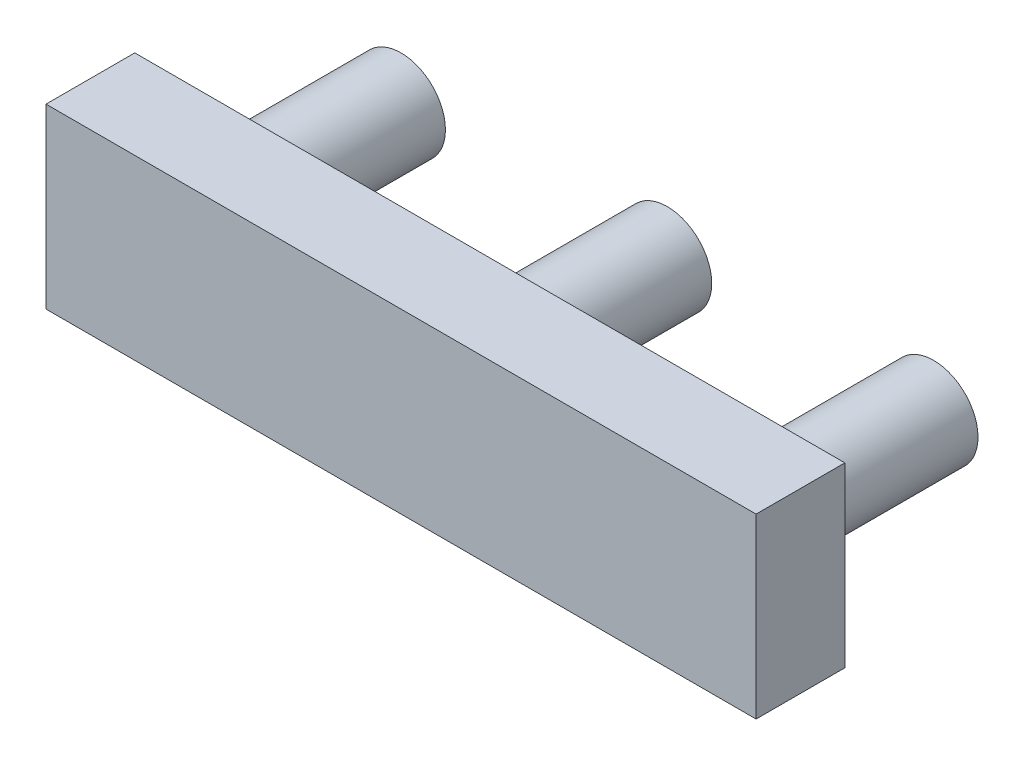
from build123d import *

# Parameters (mm, degrees)
SKETCH1_R             = 3.175
BOSS_EXTRUDE1_DEPTH   = 12.7
BOSS_EXTRUDE1_2_DEPTH = 12.7
BOSS_EXTRUDE1_3_DEPTH = 12.7
SKETCH2_W             = 50.8
SKETCH2_H             = 12.7
BOSS_EXTRUDE2_DEPTH   = 6.35


with BuildPart() as part:
    # Sketch1 → Boss-Extrude1 (new body)
    with BuildSketch(Plane.XY):
        Circle(SKETCH1_R)
    extrude(amount=BOSS_EXTRUDE1_DEPTH)



with BuildPart() as body_2:
    # Sketch1 → Boss-Extrude1 2 (new body)
    with BuildSketch(Plane.XY):
        with Locations((19.05, 0)):
            Circle(SKETCH1_R)
    extrude(amount=BOSS_EXTRUDE1_2_DEPTH)


with BuildPart() as body_3:
    # Sketch1 → Boss-Extrude1 3 (new body)
    with BuildSketch(Plane.XY):
        with Locations((-19.05, 0)):
            Circle(SKETCH1_R)
    extrude(amount=BOSS_EXTRUDE1_3_DEPTH)


with BuildPart() as part_1:
    add(part.part)

    add(body_2.part)  # Boss-Extrude2 merges body 2

    add(body_3.part)  # Boss-Extrude2 merges body 3
    # Sketch2 → Boss-Extrude2 (add)
    with BuildSketch(Plane.XY.offset(12.7)):
        Rectangle(SKETCH2_W, SKETCH2_H)
    extrude(amount=BOSS_EXTRUDE2_DEPTH)


solid = part_1.part
